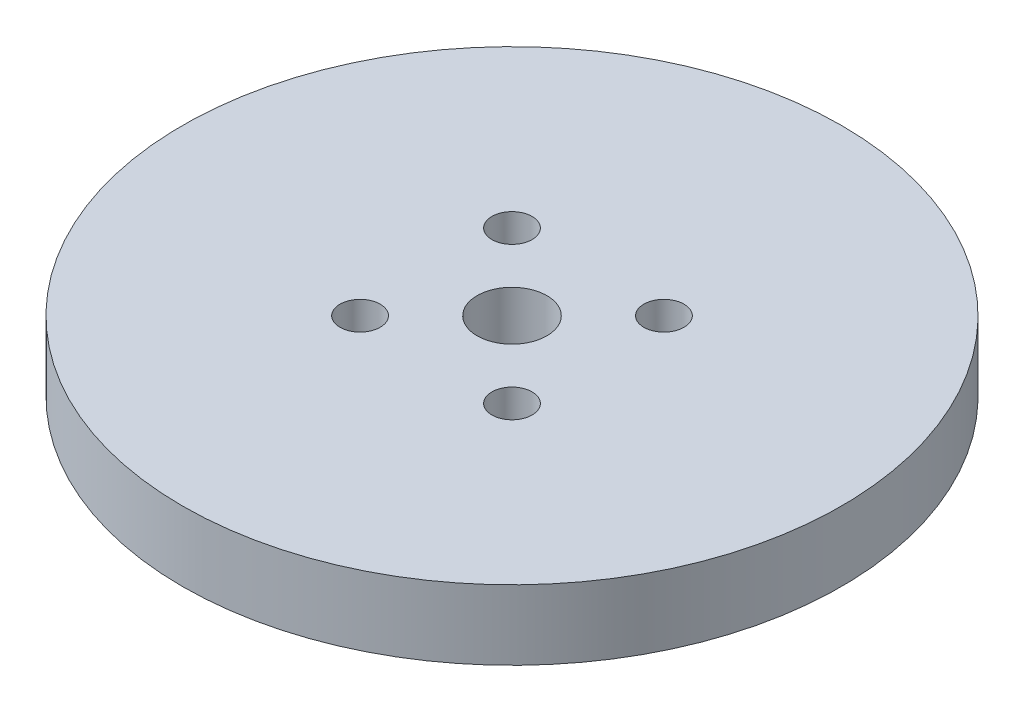
from build123d import *

# Parameters (mm, degrees)
ESQUISSE1_R             = 30
BOSS_EXTRU_1_DEPTH      = 6.35
ENL_V_MAT_EXTRU_1_REACH = 44.899
ESQUISSE2_R             = 3.175
SKETCH1_R               = 1.8288
CUT_EXTRUDE1_DEPTH      = 6.35
CIRPATTERN1_COUNT       = 4


with BuildPart() as part:
    # Esquisse1 → Boss.-Extru.1 (new body)
    with BuildSketch(Plane(origin=(0, 0, 0), x_dir=(1, 0, 0), z_dir=(0, 1, 0))):
        with Locations(Location((0, 0, 0), (0, 0, 270))):
            Circle(ESQUISSE1_R)
    extrude(amount=BOSS_EXTRU_1_DEPTH)

    # Esquisse2 → Enlèv. mat.-Extru.1 (cut, up to next)
    with BuildSketch(Plane(origin=(0, 6.35, 0), x_dir=(1, 0, 0), z_dir=(0, 1, 0)), mode=Mode.PRIVATE) as enl_v_mat_extru_1_sk1:
        with Locations(Location((0, 0, 0), (0, 0, 270))):
            Circle(ESQUISSE2_R)
    enl_v_mat_extru_1_tool1 = extrude(enl_v_mat_extru_1_sk1.sketch, amount=-ENL_V_MAT_EXTRU_1_REACH, mode=Mode.PRIVATE) & part.part
    add(enl_v_mat_extru_1_tool1.solids().sort_by_distance((0, 6.35, 0))[0], mode=Mode.SUBTRACT)

    # Sketch1 → Cut-Extrude1 (cut)
    with BuildSketch(Plane(origin=(0, 6.35, 0), x_dir=(1, 0, 0), z_dir=(0, 1, 0))):
        with Locations(Location((-6.914797213, -6.914797213, 0), (0, 0, 270))):
            Circle(SKETCH1_R)
    cut_extrude1 = extrude(amount=-CUT_EXTRUDE1_DEPTH, mode=Mode.SUBTRACT)

    # CirPattern1: Cut-Extrude1 ×4 about axis
    cirpattern1_axis = Axis((0, 0, 0), (0, 1, 0))
    for i in range(1, CIRPATTERN1_COUNT):
        add(cut_extrude1.rotate(cirpattern1_axis, i * 360 / CIRPATTERN1_COUNT), mode=Mode.SUBTRACT)


solid = part.part
